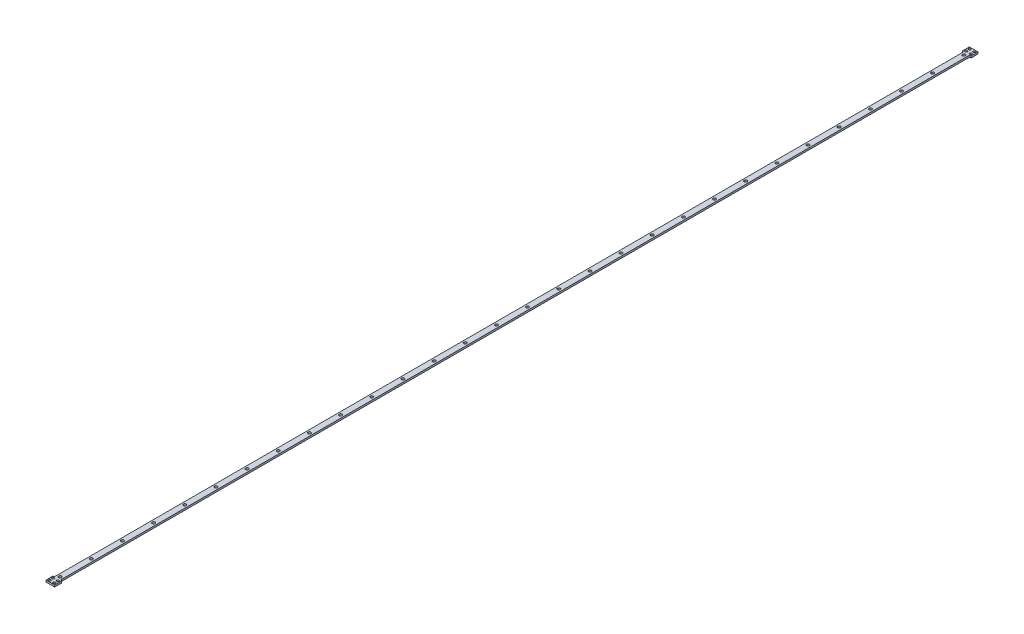
from build123d import *

# Parameters (mm, degrees)
BOSS_EXTRUDE1_DEPTH             = 3.2
SKETCH2_R                       = 2.5
CUT_EXTRUDE1_DEPTH              = 1601.073510811
F_4_0MM_DOWEL_HOLE1_D           = 4
F_4_0MM_DOWEL_HOLE1_CSINK_D     = 4.05
F_4_0MM_DOWEL_HOLE1_CSINK_ANGLE = 90
LPATTERN2_COUNT                 = 30
LPATTERN2_PITCH                 = 54


with BuildPart() as part:
    # Sketch1 → Boss-Extrude1 (new body)
    with BuildSketch(Plane(origin=(0, 0, 0), x_dir=(1, 0, 0), z_dir=(0, 1, 0))):
        with BuildLine():
            Line((0, 12), (0, 0))
            Line((0, 0), (15, 0))
            Line((15, 0), (15, 12))
            ThreePointArc((15, 12), (13.232233047, 12.732233047), (12.5, 14.5))
            Line((12.5, 14.5), (12.5, 1585.5))
            ThreePointArc((12.5, 1585.5), (13.232233047, 1587.267766953), (15, 1588))
            Line((15, 1588), (15, 1600))
            Line((15, 1600), (0, 1600))
            Line((0, 1600), (0, 1588))
            ThreePointArc((0, 1588), (1.767766953, 1587.267766953), (2.5, 1585.5))
            Line((2.5, 1585.5), (2.5, 14.5))
            ThreePointArc((2.5, 14.5), (1.767766953, 12.732233047), (0, 12))
        make_face()
    extrude(amount=BOSS_EXTRUDE1_DEPTH)

    # Sketch2 → Cut-Extrude1 (cut, through all)
    with BuildSketch(Plane(origin=(0, 3.2, 0), x_dir=(1, 0, 0), z_dir=(0, 1, 0))):
        with Locations(Location((7.5, 17, 0), (0, 0, 270))):
            Circle(SKETCH2_R)
    cut_extrude1 = extrude(amount=-CUT_EXTRUDE1_DEPTH, mode=Mode.SUBTRACT)

    # Ø4.0mm Dowel Hole1 (through all)
    with Locations(Plane(origin=(11.5, 3.2, -1591), x_dir=(0, 0, 1), z_dir=(0, 1, 0))):
        with Locations((0, 0), (0, -8), (-6, -8), (-6, 0), (1582, -8), (1588, -8), (1582, 0), (1588, 0)):
            CounterSinkHole(F_4_0MM_DOWEL_HOLE1_D / 2, F_4_0MM_DOWEL_HOLE1_CSINK_D / 2, counter_sink_angle=F_4_0MM_DOWEL_HOLE1_CSINK_ANGLE)

    # LPattern2: Cut-Extrude1 ×30
    with Locations(*[(0, 0, -i * LPATTERN2_PITCH) for i in range(1, LPATTERN2_COUNT)]):
        add(cut_extrude1, mode=Mode.SUBTRACT)


solid = part.part
